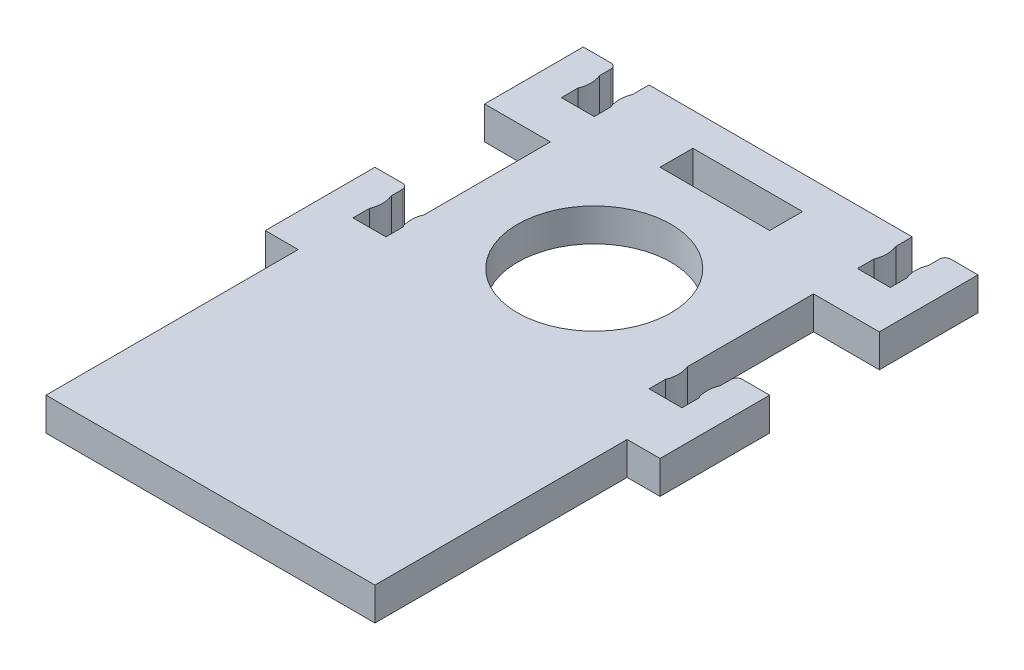
from build123d import *

# Parameters (mm, degrees)
SKETCH1_R           = 7
SKETCH1_W           = 10
SKETCH1_H           = 3
BOSS_EXTRUDE1_DEPTH = 3
FILLET1_R           = 0.5


with BuildPart() as part:
    # Sketch1 → Boss-Extrude1 (new body)
    with BuildSketch(Plane(origin=(0, 0, 0), x_dir=(1, 0, 0), z_dir=(0, 1, 0))):
        with BuildLine():
            Line((-23.198633067, -13), (6.801366933, -13))
            Line((6.801366933, -13), (6.801366933, 10))
            Line((6.801366933, 10), (9.801366933, 10))
            Line((9.801366933, 10), (9.801366933, 20))
            Line((9.801366933, 20), (6.801366933, 20))
            Line((6.801366933, 20), (6.801366933, 18.5))
            ThreePointArc((6.801366933, 18.5), (6.601366933, 17.5), (6.801366933, 16.5))
            Line((6.801366933, 16.5), (6.801366933, 15))
            Line((6.801366933, 15), (3.801366933, 15))
            Line((3.801366933, 15), (3.801366933, 16.5))
            ThreePointArc((3.801366933, 16.5), (4.001366933, 17.5), (3.801366933, 18.5))
            Line((3.801366933, 18.5), (3.801366933, 30))
            Line((3.801366933, 30), (9.801366933, 30))
            Line((9.801366933, 30), (9.801366933, 39))
            Line((9.801366933, 39), (6.801366933, 39))
            Line((6.801366933, 39), (6.801366933, 37.5))
            ThreePointArc((6.801366933, 37.5), (6.601366933, 36.5), (6.801366933, 35.5))
            Line((6.801366933, 35.5), (6.801366933, 34))
            Line((6.801366933, 34), (3.801366933, 34))
            Line((3.801366933, 34), (3.801366933, 35.5))
            ThreePointArc((3.801366933, 35.5), (4.001366933, 36.5), (3.801366933, 37.5))
            Line((3.801366933, 37.5), (3.801366933, 39))
            Line((3.801366933, 39), (-20.198633067, 39))
            Line((-20.198633067, 39), (-20.198633067, 37.5))
            ThreePointArc((-20.198633067, 37.5), (-20.398633067, 36.5), (-20.198633067, 35.5))
            Line((-20.198633067, 35.5), (-20.198633067, 34))
            Line((-20.198633067, 34), (-23.198633067, 34))
            Line((-23.198633067, 34), (-23.198633067, 35.5))
            ThreePointArc((-23.198633067, 35.5), (-22.998633067, 36.5), (-23.198633067, 37.5))
            Line((-23.198633067, 37.5), (-23.198633067, 39))
            Line((-23.198633067, 39), (-26.198633067, 39))
            Line((-26.198633067, 39), (-26.198633067, 30))
            Line((-26.198633067, 30), (-20.198633067, 30))
            Line((-20.198633067, 30), (-20.198633067, 18.5))
            ThreePointArc((-20.198633067, 18.5), (-20.398633067, 17.5), (-20.198633067, 16.5))
            Line((-20.198633067, 16.5), (-20.198633067, 15))
            Line((-20.198633067, 15), (-23.198633067, 15))
            Line((-23.198633067, 15), (-23.198633067, 16.5))
            ThreePointArc((-23.198633067, 16.5), (-22.998633067, 17.5), (-23.198633067, 18.5))
            Line((-23.198633067, 18.5), (-23.198633067, 20))
            Line((-23.198633067, 20), (-26.198633067, 20))
            Line((-26.198633067, 20), (-26.198633067, 10))
            Line((-26.198633067, 10), (-23.198633067, 10))
            Line((-23.198633067, 10), (-23.198633067, -13))
        make_face()
        with Locations(Location((-8.198633067, 22, 0), (0, 0, 270))):
            Circle(SKETCH1_R, mode=Mode.SUBTRACT)
        with Locations((-8.198633067, 34.5)):
            Rectangle(SKETCH1_W, SKETCH1_H, mode=Mode.SUBTRACT)
    extrude(amount=BOSS_EXTRUDE1_DEPTH)

    # Fillet1
    fillet1_edges = [part.edges().sort_by_distance(p)[0] for p in [
        (-23.198633067, 1.5, -39),
        (6.801366933, 1.5, -39),
        (6.801366933, 1.5, -20),
        (-23.198633067, 1.5, -20),
    ]]
    fillet(fillet1_edges, radius=FILLET1_R)


solid = part.part
